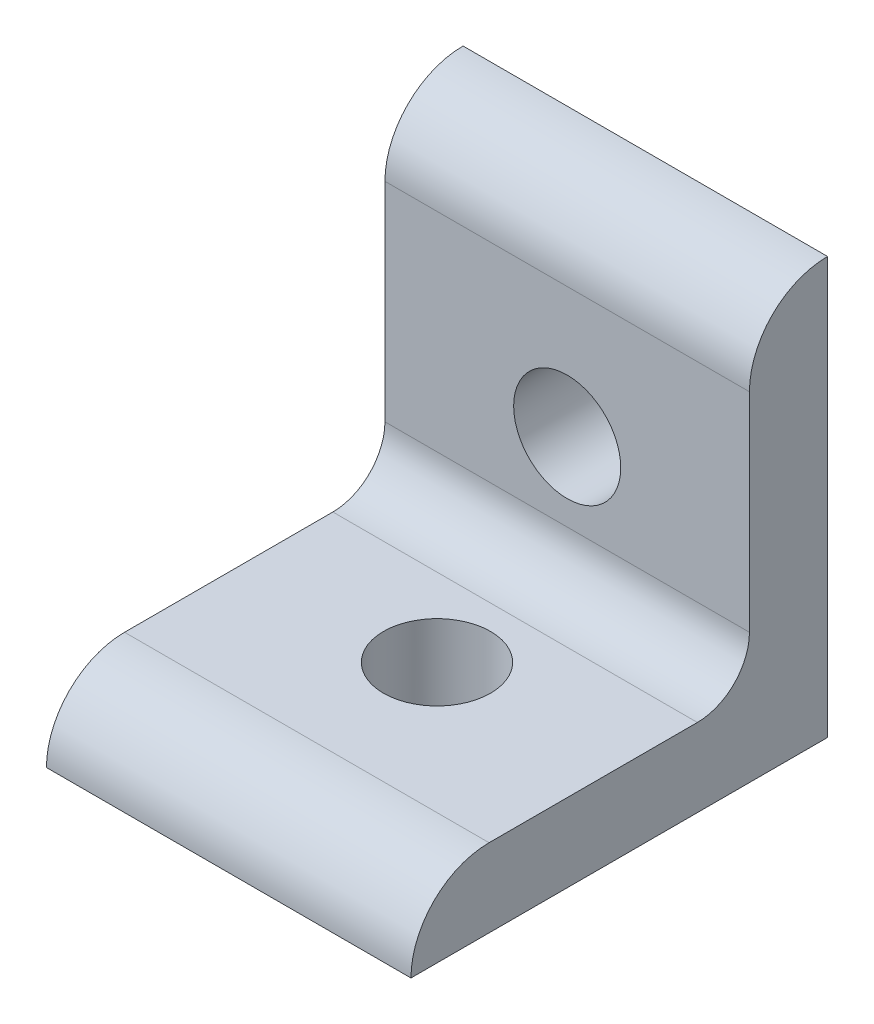
from build123d import *

# Parameters (mm, degrees)
BASE_EXTRUDE_DEPTH = 11.1125
SKETCH2_R          = 3.2639
HOLE1_DEPTH        = 38.600633721
SKETCH3_R          = 3.2639
HOLE2_DEPTH        = 38.600633721


with BuildPart() as part:
    # Sketch1 → Base Extrude (new, symmetric)
    with BuildSketch(Plane(origin=(0, 0, 0), x_dir=(0, 0, -1), z_dir=(1, 0, 0))):
        with BuildLine():
            Line((-4.7625, 7.9375), (-4.7625, 20.6375))
            ThreePointArc((-4.7625, 20.6375), (-3.367596045, 24.005096045), (0, 25.4))
            Line((0, 25.4), (0, 0))
            Line((0, 0), (-25.4, 0))
            ThreePointArc((-25.4, 0), (-24.005096045, 3.367596045), (-20.6375, 4.7625))
            Line((-20.6375, 4.7625), (-7.9375, 4.7625))
            ThreePointArc((-7.9375, 4.7625), (-5.69243597, 5.69243597), (-4.7625, 7.9375))
        make_face()
    extrude(amount=BASE_EXTRUDE_DEPTH, both=True)

    # Sketch2 → Hole1 (cut, through all)
    with BuildSketch(Plane.XZ):
        with Locations(Location((0, 12.7, 0), (0, 0, 270))):
            Circle(SKETCH2_R)
    extrude(amount=-HOLE1_DEPTH, mode=Mode.SUBTRACT)

    # Sketch3 → Hole2 (cut, through all)
    with BuildSketch(Plane(origin=(0, 0, 0), x_dir=(-1, 0, 0), z_dir=(0, 0, -1))):
        with Locations(Location((0, 12.7, 0), (0, 0, 90))):
            Circle(SKETCH3_R)
    extrude(amount=-HOLE2_DEPTH, mode=Mode.SUBTRACT)


solid = part.part
